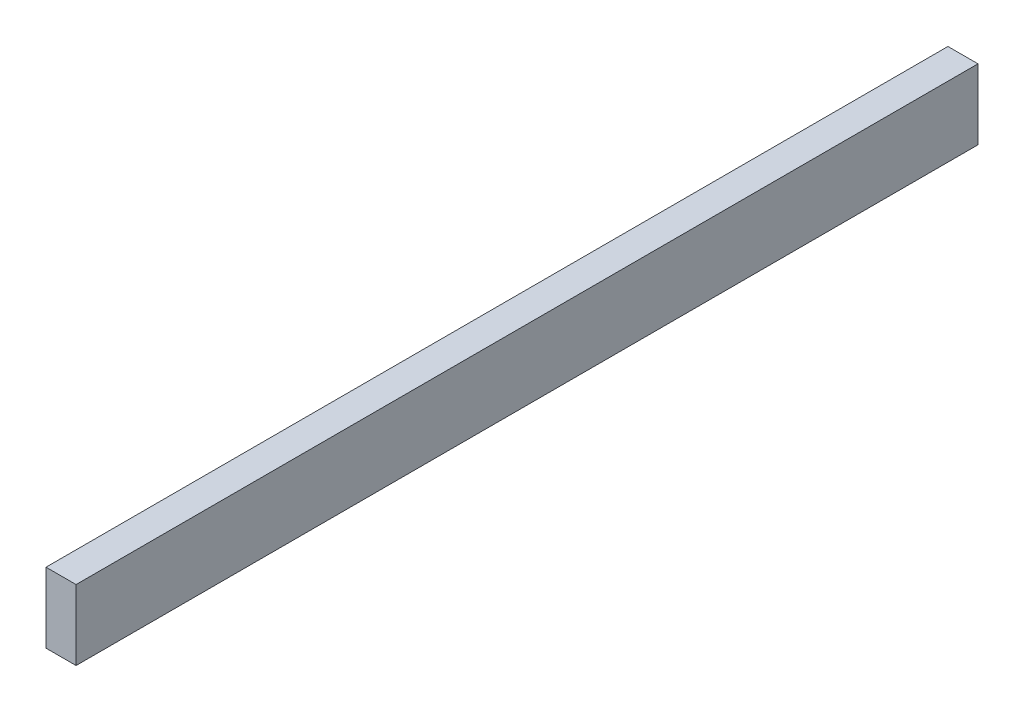
from build123d import *

# Parameters (mm, degrees)
SKETCH1_W      = 38.1
SKETCH1_H      = 88.9
EXTRUDE1_DEPTH = 571.5


with BuildPart() as part:
    # Sketch1 → Extrude1 (new, symmetric)
    with BuildSketch(Plane.XY):
        Rectangle(SKETCH1_W, SKETCH1_H)
    extrude(amount=EXTRUDE1_DEPTH, both=True)


solid = part.part
